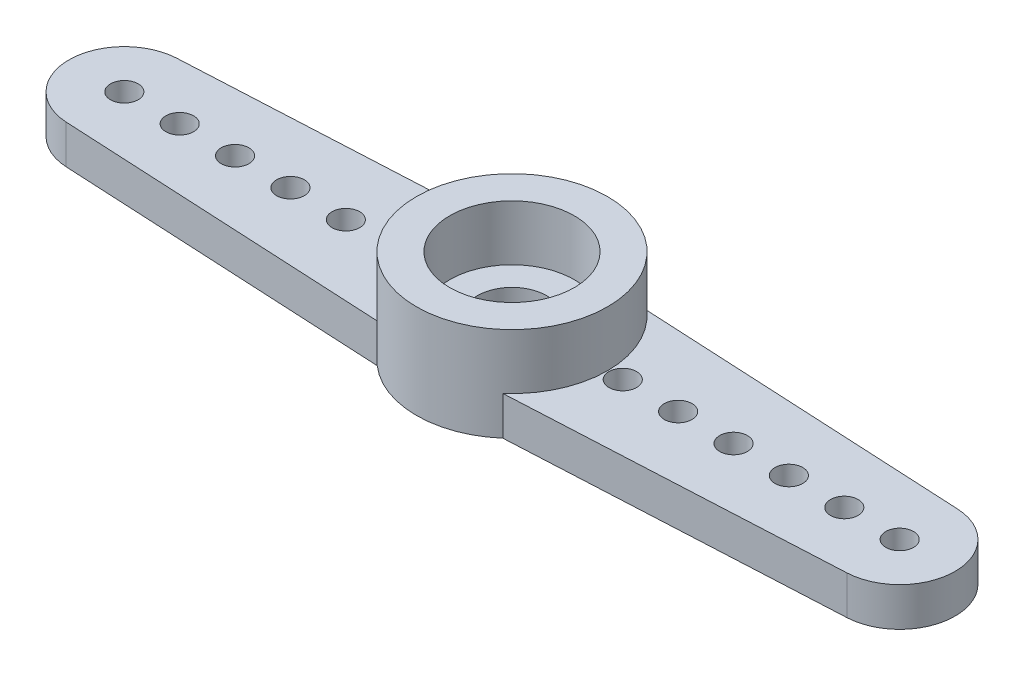
from build123d import *
from build123d.topology import SkipClean

# Parameters (mm, degrees)
RESSALTO_EXTRUS_O1_DEPTH = 1.4
ESBO_O2_R                = 3.45
RESSALTO_EXTRUS_O2_DEPTH = 2
ESBO_O3_R                = 2.25
CORTE_EXTRUS_O1_DEPTH    = 2
CORTE_EXTRUS_O2_START    = -0.5
ESBO_O4_R                = 2.25
CORTE_EXTRUS_O2_DEPTH    = 0.5
ESBO_O5_R                = 1.25
CORTE_EXTRUS_O3_DEPTH    = 17.62265021
ESBO_O6_R                = 0.5
CORTE_EXTRUS_O4_DEPTH    = 17.717131931


with BuildPart() as part:
    # Esboço1 → Ressalto-extrusão1 (new body)
    with BuildSketch(Plane(origin=(0, 0, 0), x_dir=(1, 0, 0), z_dir=(0, 1, 0))):
        with BuildLine():
            Line((-14.101708317, 1.99741218), (-2.267708094, 2.6))
            ThreePointArc((-2.267708094, 2.6), (0, 3.45), (2.267708094, 2.6))
            Line((2.267708094, 2.6), (14.101708317, 1.99741218))
            ThreePointArc((14.101708317, 1.99741218), (16, 0), (14.101708317, -1.99741218))
            Line((14.101708317, -1.99741218), (2.267708094, -2.6))
            ThreePointArc((2.267708094, -2.6), (0, -3.45), (-2.267708094, -2.6))
            Line((-2.267708094, -2.6), (-14.101708317, -1.99741218))
            ThreePointArc((-14.101708317, -1.99741218), (-16, 0), (-14.101708317, 1.99741218))
        make_face()
    extrude(amount=RESSALTO_EXTRUS_O1_DEPTH)

    # Esboço2 → Ressalto-extrusão2 (add)
    with SkipClean():  # the faces are left unmerged after this step: merging them gives an invalid solid
        with BuildSketch(Plane(origin=(0, 1.4, 0), x_dir=(1, 0, 0), z_dir=(0, 1, 0))):
            with Locations(Location((0, 0, 0), (0, 0, 48.905212005))):
                Circle(ESBO_O2_R)
        extrude(amount=RESSALTO_EXTRUS_O2_DEPTH)

    # Esboço3 → Corte-extrusão1 (cut)
    with SkipClean():  # the faces are left unmerged after this step: merging them gives an invalid solid
        with BuildSketch(Plane(origin=(0, 3.4, 0), x_dir=(1, 0, 0), z_dir=(0, 1, 0))):
            with Locations(Location((0, 0, 0), (0, 0, 270))):
                Circle(ESBO_O3_R)
        extrude(amount=-CORTE_EXTRUS_O1_DEPTH, mode=Mode.SUBTRACT)

    # Esboço4 → Corte-extrusão2 (cut)
    with SkipClean():  # the faces are left unmerged after this step: merging them gives an invalid solid
        with BuildSketch(Plane.XZ.offset(CORTE_EXTRUS_O2_START)):
            with Locations(Location((0, 0, 0), (0, 0, 90))):
                Circle(ESBO_O4_R)
        extrude(amount=CORTE_EXTRUS_O2_DEPTH, mode=Mode.SUBTRACT)

    # Esboço5 → Corte-extrusão3 (cut, through all)
    with SkipClean():  # the faces are left unmerged after this step: merging them gives an invalid solid
        with BuildSketch(Plane.XZ.offset(-0.5)):
            with Locations(Location((0, 0, 0), (0, 0, 270))):
                Circle(ESBO_O5_R)
        extrude(amount=-CORTE_EXTRUS_O3_DEPTH, mode=Mode.SUBTRACT)

    # Esboço6 → Corte-extrusão4 (cut, through all)
    with SkipClean():  # the faces are left unmerged after this step: merging them gives an invalid solid
        with BuildSketch(Plane.XZ):
            with Locations(Location((-4, 0, 0), (0, 0, 270))):
                Circle(ESBO_O6_R)
            with Locations(Location((-6, 0, 0), (0, 0, 270))):
                Circle(ESBO_O6_R)
            with Locations(Location((-8, 0, 0), (0, 0, 270))):
                Circle(ESBO_O6_R)
            with Locations(Location((-10, 0, 0), (0, 0, 270))):
                Circle(ESBO_O6_R)
            with Locations(Location((-12, 0, 0), (0, 0, 270))):
                Circle(ESBO_O6_R)
            with Locations(Location((-14, 0, 0), (0, 0, 270))):
                Circle(ESBO_O6_R)
        corte_extrus_o4 = extrude(amount=-CORTE_EXTRUS_O4_DEPTH, mode=Mode.SUBTRACT)

    # Espelhar1: Corte-extrusão4 across plane
    with SkipClean():  # the faces are left unmerged after this step: merging them gives an invalid solid
        add(corte_extrus_o4.mirror(Plane(origin=(0, 0, 0), x_dir=(0, 0, 1), z_dir=(1, 0, 0))), mode=Mode.SUBTRACT)


solid = part.part
